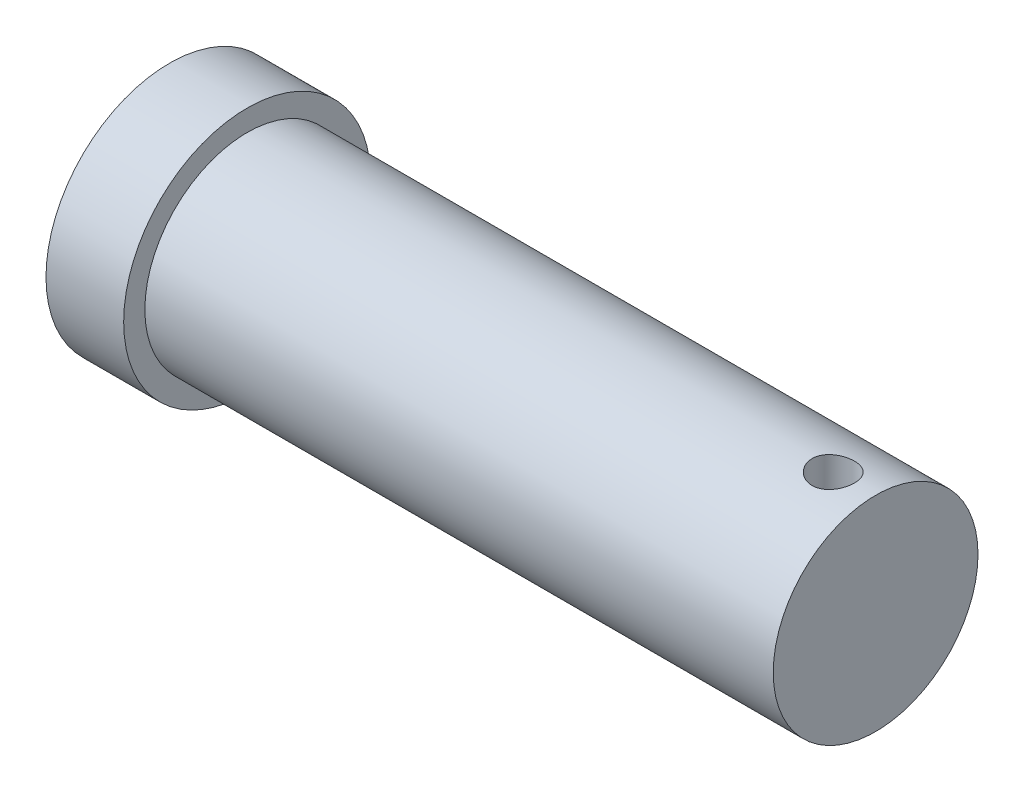
from build123d import *

# Parameters (mm, degrees)
SKETCH1_R               = 2.9
BOSS_EXTRUDE1_DEPTH     = 20
CUT_EXTRUDE1_DEPTH      = 10
CUT_EXTRUDE1_DEPTH_BACK = 10
SKETCH2_R               = 0.6
SKETCH3_R               = 3.5
BOSS_EXTRUDE2_DEPTH     = 2.2
SCALE1_SCALE            = 1.5


with BuildPart() as part:
    # Sketch1 → Boss-Extrude1 (new body)
    with BuildSketch(Plane(origin=(0, 0, 0), x_dir=(0, 0, -1), z_dir=(1, 0, 0))):
        Circle(SKETCH1_R)
    extrude(amount=BOSS_EXTRUDE1_DEPTH)

    # Sketch2 → Cut-Extrude1 (cut, two sides: drawn at the far end of the back side and taken through both)
    with BuildSketch(Plane(origin=(0, 0, 0), x_dir=(1, 0, 0), z_dir=(0, 1, 0)).offset(-CUT_EXTRUDE1_DEPTH_BACK)):
        with Locations((18.8, 0)):
            Circle(SKETCH2_R)
    extrude(amount=CUT_EXTRUDE1_DEPTH + CUT_EXTRUDE1_DEPTH_BACK, mode=Mode.SUBTRACT)

    # Sketch3 → Boss-Extrude2 (add)
    with BuildSketch(Plane.ZY):
        Circle(SKETCH3_R)
    extrude(amount=-BOSS_EXTRUDE2_DEPTH)


with BuildPart() as part_1:
    # Scale1: scaled about (0, 0, 0)
    add(part.part.scale(SCALE1_SCALE))


solid = part_1.part
